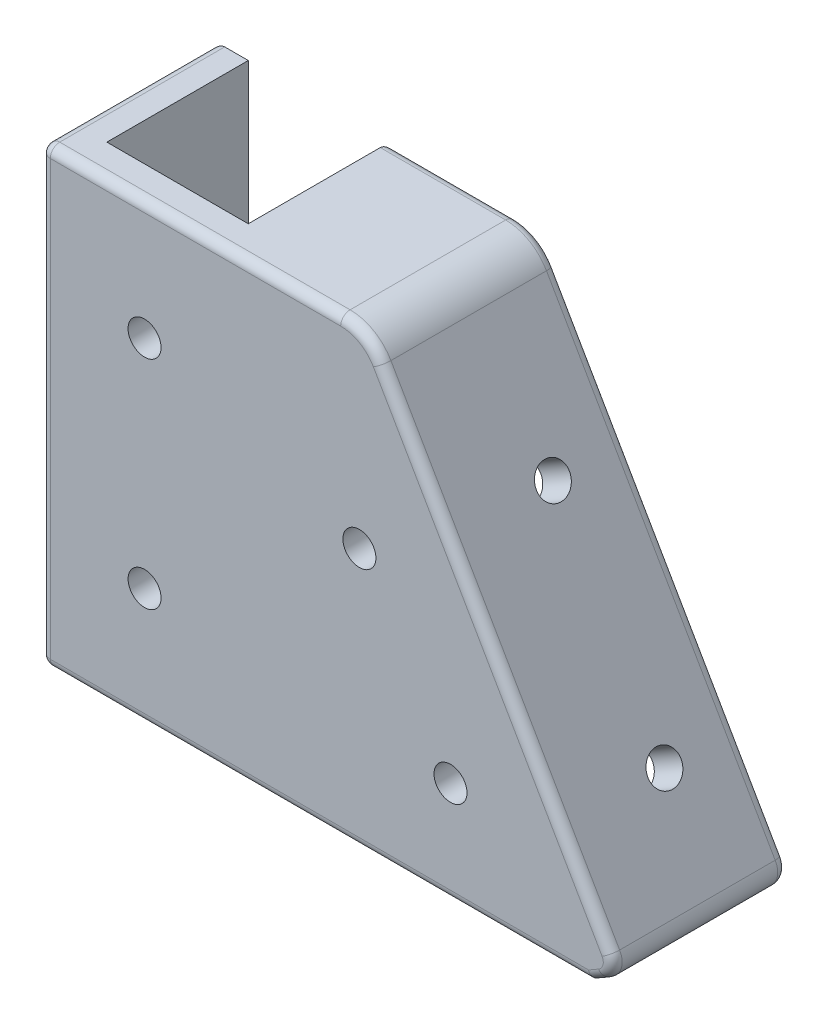
from build123d import *

# Parameters (mm, degrees)
BOSS_EXTRUDE1_DEPTH = 18.5
SKETCH2_W           = 15
SKETCH2_H           = 48
CUT_EXTRUDE1_DEPTH  = 15
SKETCH3_R           = 1.75
CUT_EXTRUDE2_DEPTH  = 3.5
SKETCH4_R           = 1.75
CUT_EXTRUDE3_DEPTH  = 4
SKETCH5_R           = 1.75
CUT_EXTRUDE4_DEPTH  = 4
CUT_EXTRUDE5_DEPTH  = 19
FILLET1_R           = 2
FILLET2_R           = 5
FILLET3_R           = 1


with BuildPart() as part:
    # Sketch1 → Boss-Extrude1 (new body)
    with BuildSketch(Plane.XY):
        Polygon((20.545588903, 15.488794989), (48.258401824, -32.511205011), (7.85498998, -32.511205011), (-14.14501002, -32.511205011), (-14.14501002, 15.488794989), align=None)
    extrude(amount=BOSS_EXTRUDE1_DEPTH)

    # Sketch2 → Cut-Extrude1 (cut)
    with BuildSketch(Plane.XY):
        with Locations((-3.14501002, -8.511205011)):
            Rectangle(SKETCH2_W, SKETCH2_H)
        Polygon((44.21694994, -32.511205011), (19.886822921, 9.62981114), (6.896441864, 2.12981114), (26.896441864, -32.511205011), align=None)
    extrude(amount=CUT_EXTRUDE1_DEPTH, mode=Mode.SUBTRACT)

    # Sketch3 → Cut-Extrude2 (cut)
    with BuildSketch(Plane(origin=(22.116036645, 12.76869971, 0), x_dir=(0, 0, -1), z_dir=(0.8660254037844378, 0.5000000000000016, 0))):
        with Locations(Location((-7.5, -37.764004417, 0), (0, 0, 90))):
            Circle(SKETCH3_R)
        with Locations(Location((-7.5, -14.103750379, 0), (0, 0, 90))):
            Circle(SKETCH3_R)
    extrude(amount=-CUT_EXTRUDE2_DEPTH, mode=Mode.SUBTRACT)

    # Sketch4 → Cut-Extrude3 (cut)
    with BuildSketch(Plane(origin=(0, 0, 18.5), x_dir=(-1, 0, 0), z_dir=(0, 0, -1))):
        with Locations(Location((-29.306695902, -21.685887464, 0), (0, 0, 180))):
            Circle(SKETCH4_R)
        with Locations(Location((-19.641632393, -4.945506407, 0), (0, 0, 180))):
            Circle(SKETCH4_R)
        with Locations(Location((3.14501002, 2.988794989, 0), (0, 0, 180))):
            Circle(SKETCH4_R)
        with Locations(Location((3.14501002, -20.011205011, 0), (0, 0, 180))):
            Circle(SKETCH4_R)
    extrude(amount=CUT_EXTRUDE3_DEPTH, mode=Mode.SUBTRACT)

    # Sketch5 → Cut-Extrude4 (cut)
    with BuildSketch(Plane.ZY.offset(14.14501002)):
        with Locations(Location((7.5, -20.011205011, 0), (0, 0, 270))):
            Circle(SKETCH5_R)
        with Locations(Location((7.5, 2.988794989, 0), (0, 0, 270))):
            Circle(SKETCH5_R)
    extrude(amount=-CUT_EXTRUDE4_DEPTH, mode=Mode.SUBTRACT)

    # Sketch6 → Cut-Extrude5 (cut)
    with BuildSketch(Plane.XY.offset(18.5)):
        Polygon((44.21694994, -32.511205011), (47.248038853, -30.761205011), (48.258401824, -32.511205011), align=None)
    extrude(amount=-CUT_EXTRUDE5_DEPTH, mode=Mode.SUBTRACT)

    # Fillet1
    fillet1_edges = [part.edges().sort_by_distance(p)[0] for p in [
        (47.248038853, -30.761205011, 9.25),
    ]]
    fillet(fillet1_edges, radius=FILLET1_R)

    # Fillet2
    fillet2_edges = [part.edges().sort_by_distance(p)[0] for p in [
        (20.545588903, 15.488794989, 9.25),
    ]]
    fillet(fillet2_edges, radius=FILLET2_R)

    # Fillet3
    fillet3_edges = [part.edges().sort_by_distance(p)[0] for p in [
        (44.866468993, -32.136205011, 0),
        (46.447839698, -30.546792294, 0),
        (11.006913769, 15.488794989, 0),
        (20.158837557, 14.818922008, 0),
        (44.866468993, -32.136205011, 18.5),
        (46.447839698, -30.546792294, 18.5),
        (1.756913769, 15.488794989, 18.5),
        (20.158837557, 14.818922008, 18.5),
        (-14.14501002, 15.488794989, 9.25),
        (-14.14501002, -32.511205011, 9.25),
        (-14.14501002, -8.511205011, 0),
        (15.625715922, -32.511205011, 0),
        (4.35498998, -8.511205011, 0),
        (34.118501715, -8.020179607, 0),
        (-14.14501002, -8.511205011, 18.5),
        (15.03596996, -32.511205011, 18.5),
        (34.118501715, -8.020179607, 18.5),
    ]]
    fillet(fillet3_edges, radius=FILLET3_R)


solid = part.part
